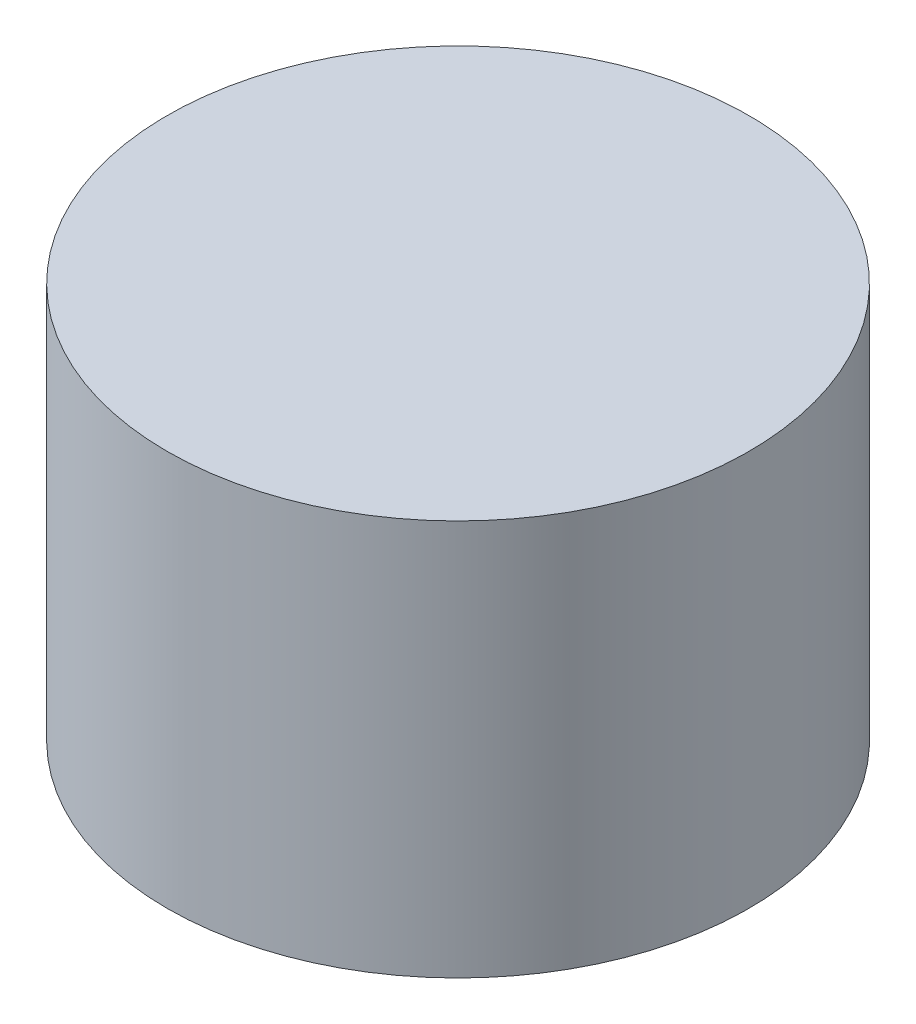
from build123d import *

# Parameters (mm, degrees)
CROQUIS1_R              = 7.35
SALIENTE_EXTRUIR1_DEPTH = 10


with BuildPart() as part:
    # Croquis1 → Saliente-Extruir1 (new body)
    with BuildSketch(Plane(origin=(0, 0, 0), x_dir=(1, 0, 0), z_dir=(0, 1, 0))):
        with Locations(Location((0, 0, 0), (0, 0, 270))):
            Circle(CROQUIS1_R)
    extrude(amount=SALIENTE_EXTRUIR1_DEPTH)


solid = part.part
